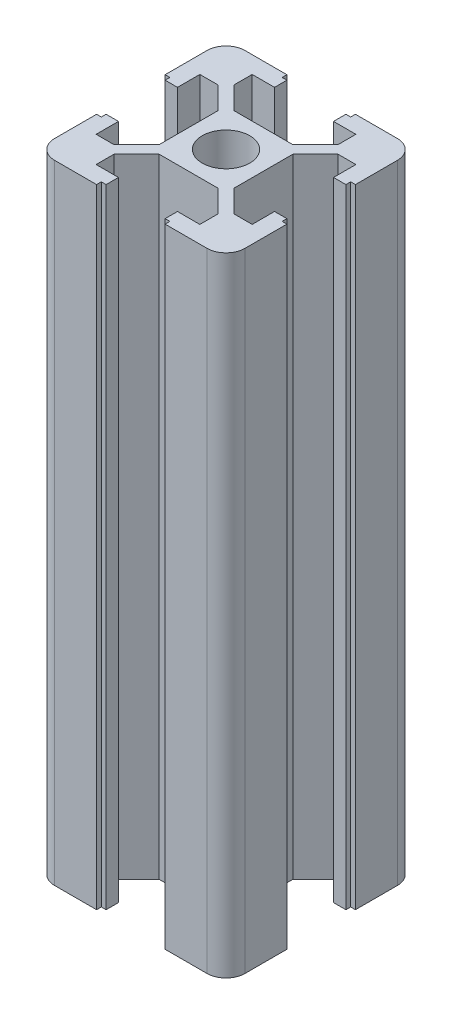
from build123d import *

# Parameters (mm, degrees)
SKETCH_1_R      = 2.5
EXTRUDE_1_DEPTH = 66


with BuildPart() as part:
    # 草图1 → 凸台-拉伸1 (new body)
    with BuildSketch(Plane(origin=(0, 0, 0), x_dir=(1, 0, 0), z_dir=(0, 1, 0))):
        with BuildLine():
            Line((-3.948528137, -3.1), (-6.298528137, -5.45))
            Line((-6.298528137, -5.45), (-8.2, -5.45))
            Line((-8.2, -5.45), (-8.2, -3.1))
            Line((-8.2, -3.1), (-9.5, -3.1))
            Line((-9.5, -3.1), (-9.5, -3.6))
            Line((-9.5, -3.6), (-10, -3.6))
            Line((-10, -3.6), (-10, -8))
            ThreePointArc((-10, -8), (-9.414213562, -9.414213562), (-8, -10))
            Line((-8, -10), (-3.6, -10))
            Line((-3.6, -10), (-3.6, -9.5))
            Line((-3.6, -9.5), (-3.1, -9.5))
            Line((-3.1, -9.5), (-3.1, -8.2))
            Line((-3.1, -8.2), (-5.45, -8.2))
            Line((-5.45, -8.2), (-5.45, -6.298528137))
            Line((-5.45, -6.298528137), (-3.1, -3.948528137))
            Line((-3.1, -3.948528137), (0, -3.948528137))
            Line((0, -3.948528137), (3.1, -3.948528137))
            Line((3.1, -3.948528137), (5.45, -6.298528137))
            Line((5.45, -6.298528137), (5.45, -8.2))
            Line((5.45, -8.2), (3.1, -8.2))
            Line((3.1, -8.2), (3.1, -9.5))
            Line((3.1, -9.5), (3.6, -9.5))
            Line((3.6, -9.5), (3.6, -10))
            Line((3.6, -10), (8, -10))
            ThreePointArc((8, -10), (9.414213562, -9.414213562), (10, -8))
            Line((10, -8), (10, -3.6))
            Line((10, -3.6), (9.5, -3.6))
            Line((9.5, -3.6), (9.5, -3.1))
            Line((9.5, -3.1), (8.2, -3.1))
            Line((8.2, -3.1), (8.2, -5.45))
            Line((8.2, -5.45), (6.298528137, -5.45))
            Line((6.298528137, -5.45), (3.948528137, -3.1))
            Line((3.948528137, -3.1), (3.948528137, 0))
            Line((3.948528137, 0), (3.948528137, 3.1))
            Line((3.948528137, 3.1), (6.298528137, 5.45))
            Line((6.298528137, 5.45), (8.2, 5.45))
            Line((8.2, 5.45), (8.2, 3.1))
            Line((8.2, 3.1), (9.5, 3.1))
            Line((9.5, 3.1), (9.5, 3.6))
            Line((9.5, 3.6), (10, 3.6))
            Line((10, 3.6), (10, 8))
            ThreePointArc((10, 8), (9.414213562, 9.414213562), (8, 10))
            Line((8, 10), (3.6, 10))
            Line((3.6, 10), (3.6, 9.5))
            Line((3.6, 9.5), (3.1, 9.5))
            Line((3.1, 9.5), (3.1, 8.2))
            Line((3.1, 8.2), (5.45, 8.2))
            Line((5.45, 8.2), (5.45, 6.298528137))
            Line((5.45, 6.298528137), (3.1, 3.948528137))
            Line((3.1, 3.948528137), (0, 3.948528137))
            Line((0, 3.948528137), (-3.1, 3.948528137))
            Line((-3.1, 3.948528137), (-5.45, 6.298528137))
            Line((-5.45, 6.298528137), (-5.45, 8.2))
            Line((-5.45, 8.2), (-3.1, 8.2))
            Line((-3.1, 8.2), (-3.1, 9.5))
            Line((-3.1, 9.5), (-3.6, 9.5))
            Line((-3.6, 9.5), (-3.6, 10))
            Line((-3.6, 10), (-8, 10))
            ThreePointArc((-8, 10), (-9.414213562, 9.414213562), (-10, 8))
            Line((-10, 8), (-10, 3.6))
            Line((-10, 3.6), (-9.5, 3.6))
            Line((-9.5, 3.6), (-9.5, 3.1))
            Line((-9.5, 3.1), (-8.2, 3.1))
            Line((-8.2, 3.1), (-8.2, 5.45))
            Line((-8.2, 5.45), (-6.298528137, 5.45))
            Line((-6.298528137, 5.45), (-3.948528137, 3.1))
            Line((-3.948528137, 3.1), (-3.948528137, 0))
            Line((-3.948528137, 0), (-3.948528137, -3.1))
        make_face()
        with Locations(Location((0, 0, 0), (0, 0, 270))):
            Circle(SKETCH_1_R, mode=Mode.SUBTRACT)
    extrude(amount=EXTRUDE_1_DEPTH)


solid = part.part
